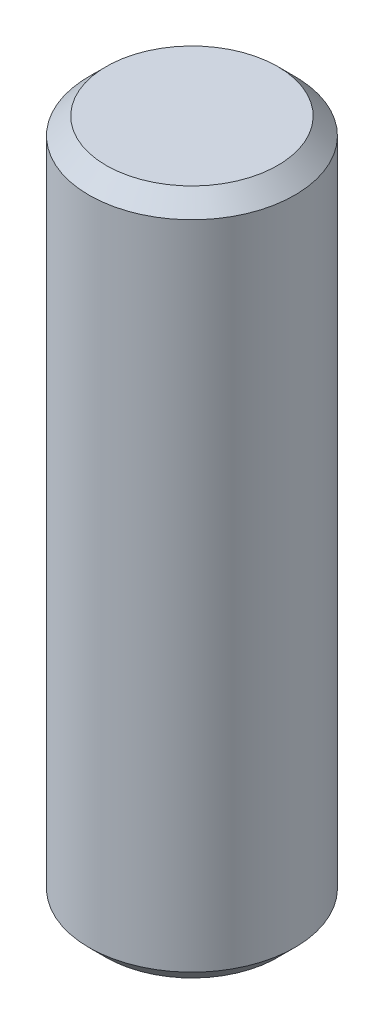
from build123d import *

# Parameters (mm, degrees)
SKETCH1_R           = 3
BOSS_EXTRUDE1_DEPTH = 10
CHAMFER1_SIZE       = 0.5


with BuildPart() as part:
    # Sketch1 → Boss-Extrude1 (new, symmetric)
    with BuildSketch(Plane(origin=(0, 0, 0), x_dir=(1, 0, 0), z_dir=(0, 1, 0))):
        with Locations(Location((0, 0, 0), (0, 0, 270))):
            Circle(SKETCH1_R)
    extrude(amount=BOSS_EXTRUDE1_DEPTH, both=True)

    # Chamfer1
    chamfer1_edges = [part.edges().sort_by_distance(p)[0] for p in [
        (0, -10, -3),
        (0, 10, -3),
    ]]
    chamfer(chamfer1_edges, length=CHAMFER1_SIZE)


solid = part.part
